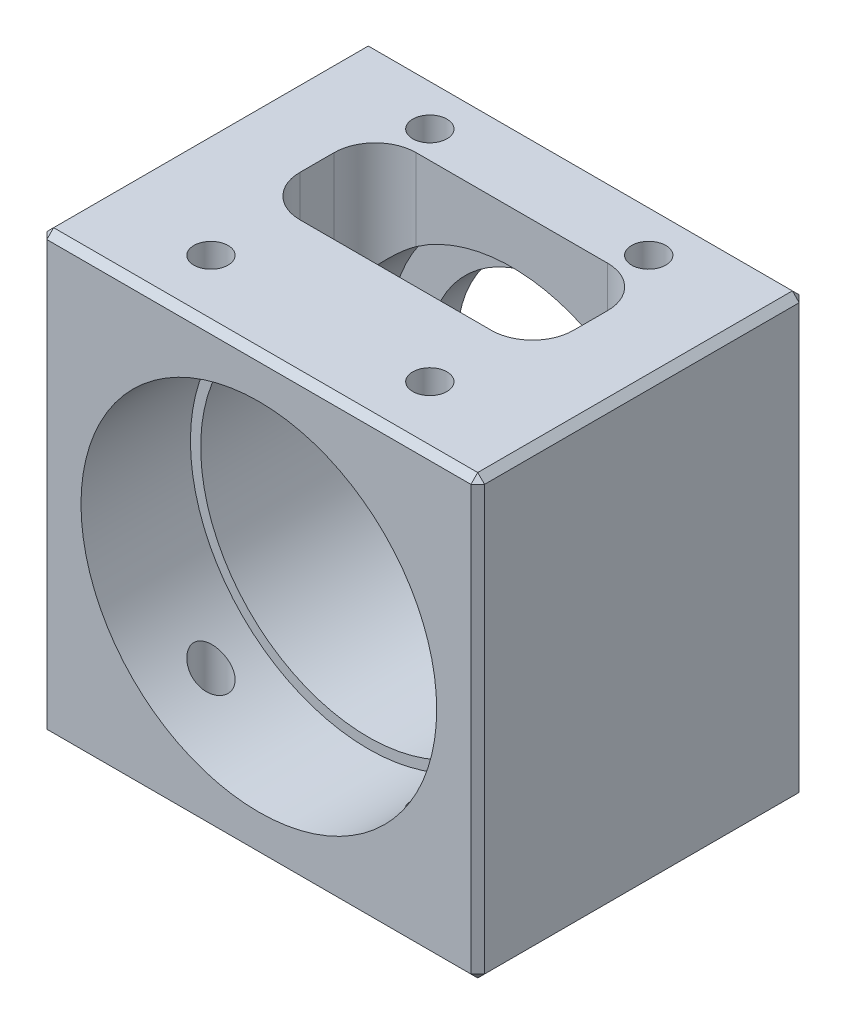
from build123d import *

# Parameters (mm, degrees)
SKETCH_1_R               = 16
SKETCH_1_R_2             = 6.65
EXTRUDE_1_DEPTH          = 24
SKETCH_3_R               = 1.5
CUT_EXTRUDE_2_DEPTH      = 33.984845005
PATTERN_CIRCULAR_1_COUNT = 6
EXTRUDE_START            = -24
EXTRUDE_2_DEPTH          = 24
SKETCH_7_R               = 13
CUT_EXTRUDE_3_DEPTH      = 21.8
EXTRUDE_START_2          = 13.8
SKETCH_15_R              = 13
SKETCH_15_R_2            = 12.25
EXTRUDE_4_DEPTH          = 13.8
SKETCH_11_W              = 20
SKETCH_11_H              = 8.5
CUT_EXTRUDE_4_DEPTH      = 10
FILLET_1_R               = 3
SKETCH_12_R              = 1
CUT_EXTRUDE_5_DEPTH      = 44.081318457
HOLE_WIZARD_M3_1_D       = 2.5
CHAMFER_1_SIZE           = 0.5
SKETCH_19_R              = 11
EXTRUDE_8_DEPTH          = 24
SKETCH_20_R              = 11
CUT_EXTRUDE_8_DEPTH      = 47
SKETCH_21_R              = 11
CUT_EXTRUDE_9_DEPTH      = 60
SKETCH_22_R              = 9.5
CUT_EXTRUDE_10_DEPTH     = 60


with BuildPart() as part:
    # 草图1 → 凸台-拉伸1 (new body)
    with BuildSketch(Plane.XY):
        Circle(SKETCH_1_R)
        Circle(SKETCH_1_R_2, mode=Mode.SUBTRACT)
    extrude(amount=EXTRUDE_1_DEPTH)

    # 草图3 → 切除-拉伸2 (cut, through all)
    with BuildSketch(Plane(origin=(0, 0, 0), x_dir=(-1, 0, 0), z_dir=(0, 0, -1))):
        with Locations((0, 9.5)):
            Circle(SKETCH_3_R)
    cut_extrude_2 = extrude(amount=-CUT_EXTRUDE_2_DEPTH, mode=Mode.SUBTRACT)

    # 阵列(圆周)1: 切除-拉伸2 ×6 about axis
    pattern_circular_1_axis = Axis((0, 0, 0), (0, 0, 1))
    for i in range(1, PATTERN_CIRCULAR_1_COUNT):
        add(cut_extrude_2.rotate(pattern_circular_1_axis, i * 360 / PATTERN_CIRCULAR_1_COUNT), mode=Mode.SUBTRACT)

    # 草图4 → 凸台-拉伸2 (add)
    with BuildSketch(Plane.XY.offset(24).offset(EXTRUDE_START)):
        with BuildLine():
            ThreePointArc((16, 0), (11.313708518, -11.31370848), (5.5e-08, -16))
            Line((5.5e-08, -16), (16, -16))
            Line((16, -16), (16, 0))
        make_face()
        with BuildLine():
            ThreePointArc((5.5e-08, -16), (-11.31370848, -11.313708518), (-16, 0))
            Line((-16, 0), (-16, -16))
            Line((-16, -16), (5.5e-08, -16))
        make_face()
        with BuildLine():
            Line((-16, 16), (-16, 0))
            ThreePointArc((-16, 0), (-11.313708518, 11.31370848), (-5.5e-08, 16))
            Line((-5.5e-08, 16), (-16, 16))
        make_face()
        with BuildLine():
            Line((16, 16), (-5.5e-08, 16))
            ThreePointArc((-5.5e-08, 16), (11.31370848, 11.313708518), (16, 0))
            Line((16, 0), (16, 16))
        make_face()
    extrude(amount=EXTRUDE_2_DEPTH)

    # 草图7 → 切除-拉伸3 (cut)
    with BuildSketch(Plane.XY.offset(24)):
        Circle(SKETCH_7_R)
    extrude(amount=-CUT_EXTRUDE_3_DEPTH, mode=Mode.SUBTRACT)

    # 草图15 → 凸台-拉伸4 (add)
    with BuildSketch(Plane.XY.offset(2.2).offset(EXTRUDE_START_2)):
        Circle(SKETCH_15_R)
        Circle(SKETCH_15_R_2, mode=Mode.SUBTRACT)
    extrude(amount=-EXTRUDE_4_DEPTH)

    # 草图11 → 切除-拉伸4 (cut)
    with BuildSketch(Plane(origin=(0, 16, 0), x_dir=(1, 0, 0), z_dir=(0, 1, 0))):
        with Locations((0, -9.75)):
            Rectangle(SKETCH_11_W, SKETCH_11_H)
    extrude(amount=-CUT_EXTRUDE_4_DEPTH, mode=Mode.SUBTRACT)

    # 圆角1
    fillet_1_edges = [part.edges().sort_by_distance(p)[0] for p in [
        (10, 11.537742925, 5.5),
        (10, 11.537742925, 14),
        (-10, 11.537742925, 14),
        (-10, 11.537742925, 5.5),
    ]]
    fillet(fillet_1_edges, radius=FILLET_1_R)

    # 草图12 → 切除-拉伸5 (cut, through all)
    with BuildSketch(Plane(origin=(0, 16, 0), x_dir=(1, 0, 0), z_dir=(0, 1, 0))):
        with Locations(Location((8, -3.5, 0), (0, 0, 180))):
            Circle(SKETCH_12_R)
        with Locations(Location((8, -19.5, 0), (0, 0, 180))):
            Circle(SKETCH_12_R)
        with Locations(Location((-8, -3.5, 0), (0, 0, 180))):
            Circle(SKETCH_12_R)
        with Locations(Location((-8, -19.5, 0), (0, 0, 180))):
            Circle(SKETCH_12_R)
    extrude(amount=-CUT_EXTRUDE_5_DEPTH, mode=Mode.SUBTRACT)

    # M3 螺纹孔1 (through all)
    with Locations(Plane(origin=(0, 16, 0), x_dir=(1, 0, 0), z_dir=(0, 1, 0))):
        with Locations((8, -3.5), (-8, -3.5), (-8, -19.5), (8, -19.5)):
            Hole(HOLE_WIZARD_M3_1_D / 2)

    # 倒角1
    chamfer_1_edges = [part.edges().sort_by_distance(p)[0] for p in [
        (0, -16, 24),
        (16, -16, 12),
        (16, 0, 0),
        (16, 0, 24),
        (0, -16, 0),
        (-16, -16, 12),
        (-16, 0, 24),
        (-16, 0, 0),
        (0, 16, 0),
        (-16, 16, 12),
        (0, 16, 24),
        (16, 16, 12),
    ]]
    chamfer(chamfer_1_edges, length=CHAMFER_1_SIZE)

    # 草图19 → 凸台-拉伸8 (add)
    with BuildSketch(Plane(origin=(0, 0, 0), x_dir=(-1, 0, 0), z_dir=(0, 0, -1))):
        Circle(SKETCH_19_R)
    extrude(amount=-EXTRUDE_8_DEPTH)

    # 草图20 → 切除-拉伸8 (cut)
    with BuildSketch(Plane.XY.offset(5.5)):
        Circle(SKETCH_20_R)
    extrude(amount=CUT_EXTRUDE_8_DEPTH, mode=Mode.SUBTRACT)

    # 草图21 → 切除-拉伸9 (cut)
    with BuildSketch(Plane.XY.offset(2.2)):
        Circle(SKETCH_21_R)
    extrude(amount=CUT_EXTRUDE_9_DEPTH, mode=Mode.SUBTRACT)

    # 草图22 → 切除-拉伸10 (cut)
    with BuildSketch(Plane(origin=(0, 0, 0), x_dir=(-1, 0, 0), z_dir=(0, 0, -1))):
        Circle(SKETCH_22_R)
    extrude(amount=-CUT_EXTRUDE_10_DEPTH, mode=Mode.SUBTRACT)


solid = part.part
